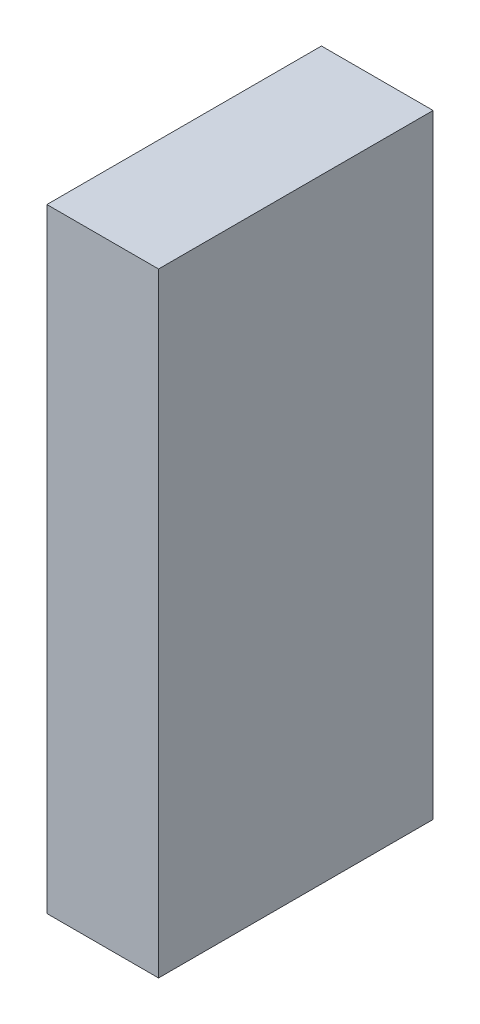
from build123d import *

# Parameters (mm, degrees)
SKETCH1_W           = 23.091985014
SKETCH1_H           = 56.787432536
BOSS_EXTRUDE1_DEPTH = 127


with BuildPart() as part:
    # Sketch1 → Boss-Extrude1 (new body)
    with BuildSketch(Plane(origin=(0, 0, 0), x_dir=(1, 0, 0), z_dir=(0, 1, 0))):
        Rectangle(SKETCH1_W, SKETCH1_H)
    extrude(amount=BOSS_EXTRUDE1_DEPTH)


solid = part.part
